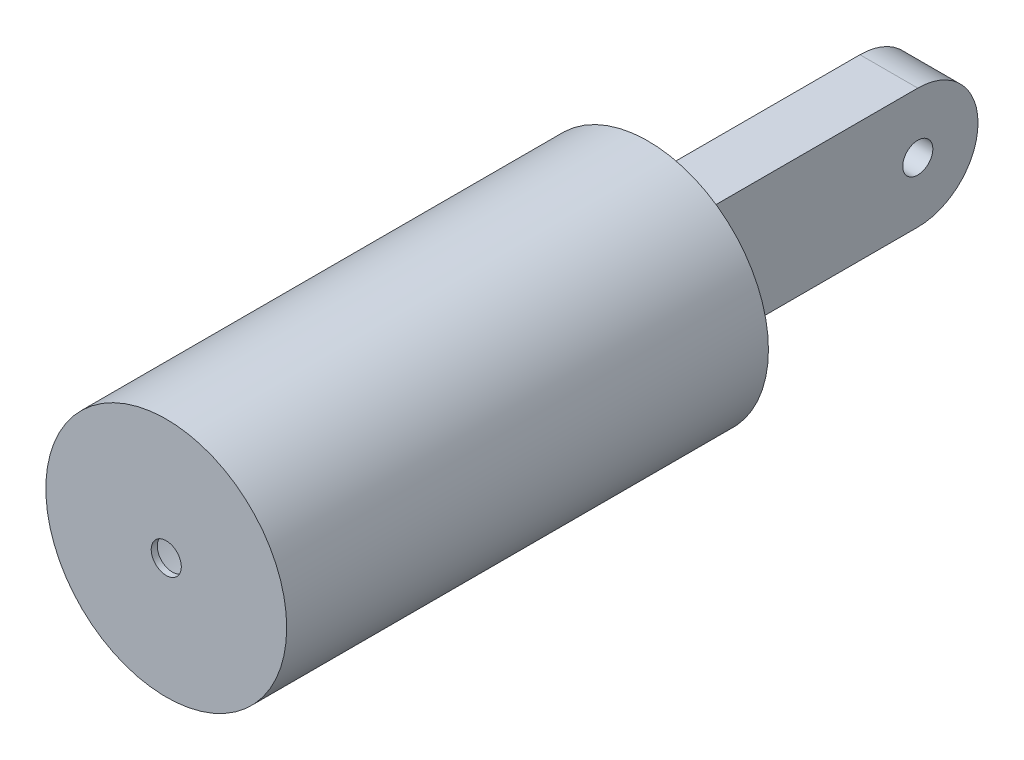
from build123d import *

# Parameters (mm, degrees)
SKETCH1_R           = 10
BOSS_EXTRUDE1_DEPTH = 20
SKETCH3_R           = 9.75
CUT_EXTRUDE1_DEPTH  = 19.5
SKETCH4_R           = 1.25
CUT_EXTRUDE2_DEPTH  = 1
BOSS_EXTRUDE2_DEPTH = 2.4
SKETCH7_R           = 1.25
CUT_EXTRUDE4_DEPTH  = 10


with BuildPart() as part:
    # Sketch1 → Boss-Extrude1 (new, symmetric)
    with BuildSketch(Plane.XY):
        Circle(SKETCH1_R)
    extrude(amount=BOSS_EXTRUDE1_DEPTH, both=True)

    # Sketch3 → Cut-Extrude1 (cut, symmetric)
    with BuildSketch(Plane.XY):
        Circle(SKETCH3_R)
    extrude(amount=CUT_EXTRUDE1_DEPTH, both=True, mode=Mode.SUBTRACT)

    # Sketch4 → Cut-Extrude2 (cut)
    with BuildSketch(Plane.XY.offset(20)):
        Circle(SKETCH4_R)
    extrude(amount=-CUT_EXTRUDE2_DEPTH, mode=Mode.SUBTRACT)

    # Sketch5 → Boss-Extrude2 (add, symmetric)
    with BuildSketch(Plane(origin=(0, 0, 0), x_dir=(0, 0, -1), z_dir=(1, 0, 0))):
        with BuildLine():
            Line((20, 5), (20, -5))
            Line((20, -5), (40, -5))
            ThreePointArc((40, -5), (45, 0), (40, 5))
            Line((40, 5), (20, 5))
        make_face()
    extrude(amount=BOSS_EXTRUDE2_DEPTH, both=True)

    # Sketch7 → Cut-Extrude4 (cut)
    with BuildSketch(Plane(origin=(2.4, 0, 0), x_dir=(0, 0, -1), z_dir=(1, 0, 0))):
        with Locations((40, 0)):
            Circle(SKETCH7_R)
    extrude(amount=-CUT_EXTRUDE4_DEPTH, mode=Mode.SUBTRACT)


solid = part.part
